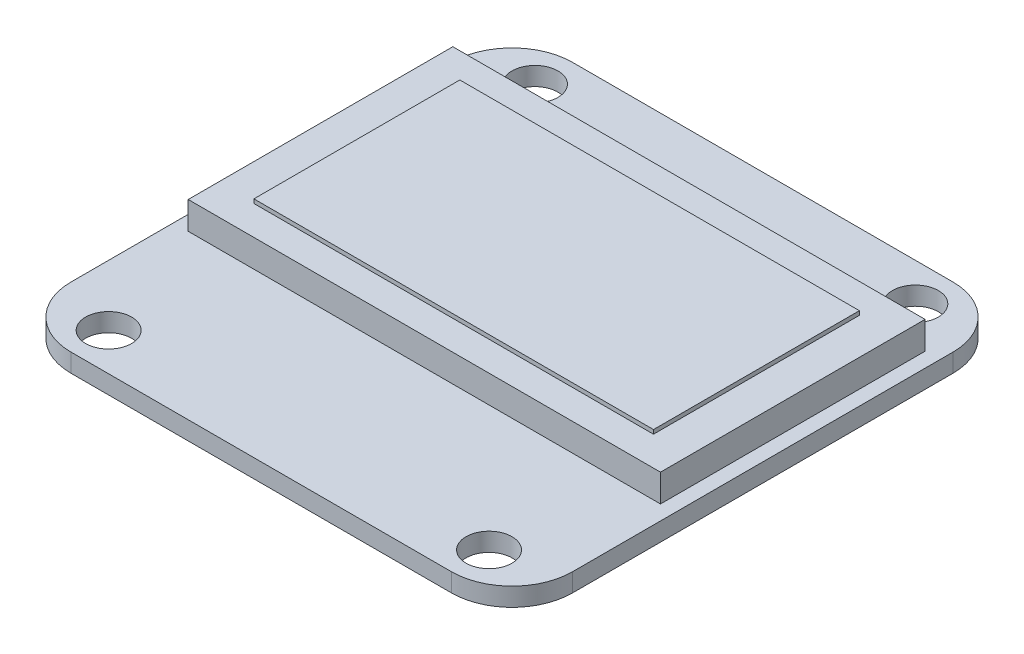
from build123d import *

# Parameters (mm, degrees)
SKETCH1_R           = 1.25
BOSS_EXTRUDE1_DEPTH = 1
SKETCH2_W           = 25.7
SKETCH2_H           = 14.4
BOSS_EXTRUDE2_DEPTH = 1.5
SKETCH4_W           = 21.744
SKETCH4_H           = 11.204
BOSS_EXTRUDE3_DEPTH = 0.22


with BuildPart() as part:
    # Sketch1 → Boss-Extrude1 (new body)
    with BuildSketch(Plane(origin=(0, 0, 0), x_dir=(1, 0, 0), z_dir=(0, 1, 0))):
        with BuildLine():
            Line((-10.35, -13.65), (10.35, -13.65))
            ThreePointArc((10.35, -13.65), (12.683452378, -12.683452378), (13.65, -10.35))
            Line((13.65, -10.35), (13.65, 10.35))
            ThreePointArc((13.65, 10.35), (12.683452378, 12.683452378), (10.35, 13.65))
            Line((10.35, 13.65), (-10.35, 13.65))
            ThreePointArc((-10.35, 13.65), (-12.683452378, 12.683452378), (-13.65, 10.35))
            Line((-13.65, 10.35), (-13.65, -10.35))
            ThreePointArc((-13.65, -10.35), (-12.683452378, -12.683452378), (-10.35, -13.65))
        make_face()
        with Locations(Location((-10.35, 11.6, 0), (0, 0, 270))):
            Circle(SKETCH1_R, mode=Mode.SUBTRACT)
        with Locations(Location((10.35, 11.6, 0), (0, 0, 270))):
            Circle(SKETCH1_R, mode=Mode.SUBTRACT)
        with Locations(Location((10.35, -11.6, 0), (0, 0, 270))):
            Circle(SKETCH1_R, mode=Mode.SUBTRACT)
        with Locations(Location((-10.35, -11.6, 0), (0, 0, 270))):
            Circle(SKETCH1_R, mode=Mode.SUBTRACT)
    extrude(amount=BOSS_EXTRUDE1_DEPTH)

    # Sketch2 → Boss-Extrude2 (add)
    with BuildSketch(Plane(origin=(0, 1, 0), x_dir=(1, 0, 0), z_dir=(0, 1, 0))):
        with Locations((0, 2.43)):
            Rectangle(SKETCH2_W, SKETCH2_H)
    extrude(amount=BOSS_EXTRUDE2_DEPTH)

    # Sketch4 → Boss-Extrude3 (add)
    with BuildSketch(Plane(origin=(0, 2.5, 0), x_dir=(1, 0, 0), z_dir=(0, 1, 0))):
        with Locations((0, 2.43)):
            Rectangle(SKETCH4_W, SKETCH4_H)
    extrude(amount=BOSS_EXTRUDE3_DEPTH)


solid = part.part
